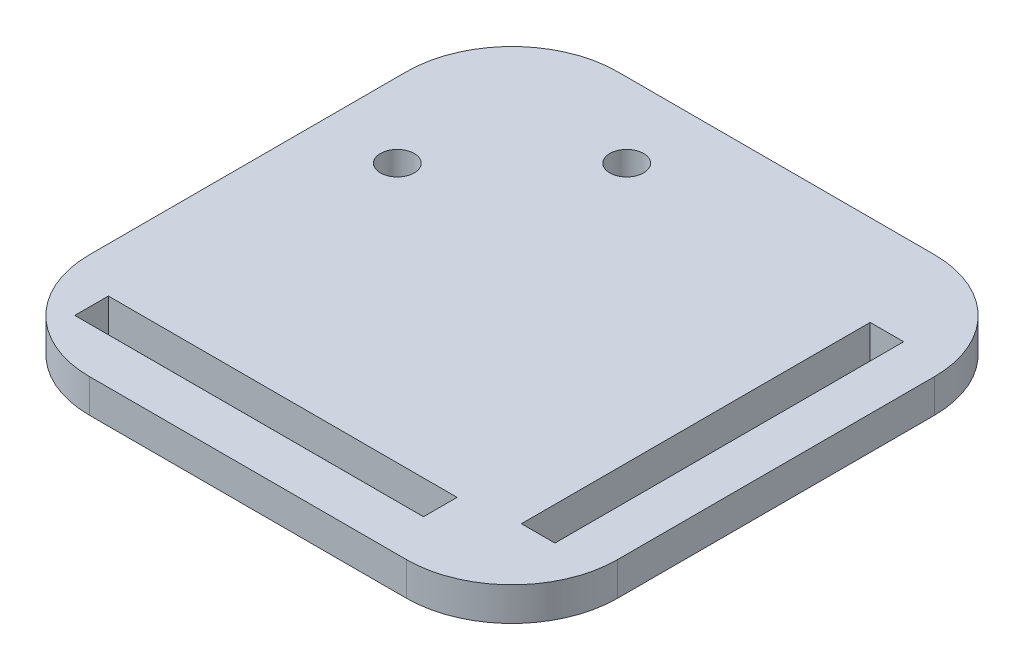
from build123d import *

# Parameters (mm, degrees)
SKETCH1_W           = 50
SKETCH1_H           = 50
BOSS_EXTRUDE1_DEPTH = 3.175
SKETCH2_W           = 3.175
SKETCH2_H           = 33.02
SKETCH2_W_2         = 33.02
SKETCH2_H_2         = 3.18
CUT_EXTRUDE1_DEPTH  = 36.497614356
SKETCH3_R           = 1.6
CUT_EXTRUDE2_DEPTH  = 36.497614356
FILLET1_R           = 10


with BuildPart() as part:
    # Sketch1 → Boss-Extrude1 (new body)
    with BuildSketch(Plane(origin=(0, 0, 0), x_dir=(1, 0, 0), z_dir=(0, 1, 0))):
        Rectangle(SKETCH1_W, SKETCH1_H)
    extrude(amount=BOSS_EXTRUDE1_DEPTH)

    # Sketch2 → Cut-Extrude1 (cut, through all)
    with BuildSketch(Plane(origin=(0, 3.175, 0), x_dir=(1, 0, 0), z_dir=(0, 1, 0))):
        with Locations((19.0945, -0.108)):
            Rectangle(SKETCH2_W, SKETCH2_H)
        with Locations((-4.21, -19.09)):
            Rectangle(SKETCH2_W_2, SKETCH2_H_2)
    extrude(amount=-CUT_EXTRUDE1_DEPTH, mode=Mode.SUBTRACT)

    # Sketch3 → Cut-Extrude2 (cut, through all)
    with BuildSketch(Plane(origin=(0, 3.175, 0), x_dir=(1, 0, 0), z_dir=(0, 1, 0))):
        with Locations(Location((-7.071067812, 17.928932188, 0), (0, 0, 270))):
            Circle(SKETCH3_R)
        with Locations(Location((-17.928932188, 7.071067812, 0), (0, 0, 270))):
            Circle(SKETCH3_R)
    extrude(amount=-CUT_EXTRUDE2_DEPTH, mode=Mode.SUBTRACT)

    # Fillet1
    fillet1_edges = [part.edges().sort_by_distance(p)[0] for p in [
        (25, 1.5875, 25),
        (-25, 1.5875, 25),
        (-25, 1.5875, -25),
        (25, 1.5875, -25),
    ]]
    fillet(fillet1_edges, radius=FILLET1_R)


solid = part.part
